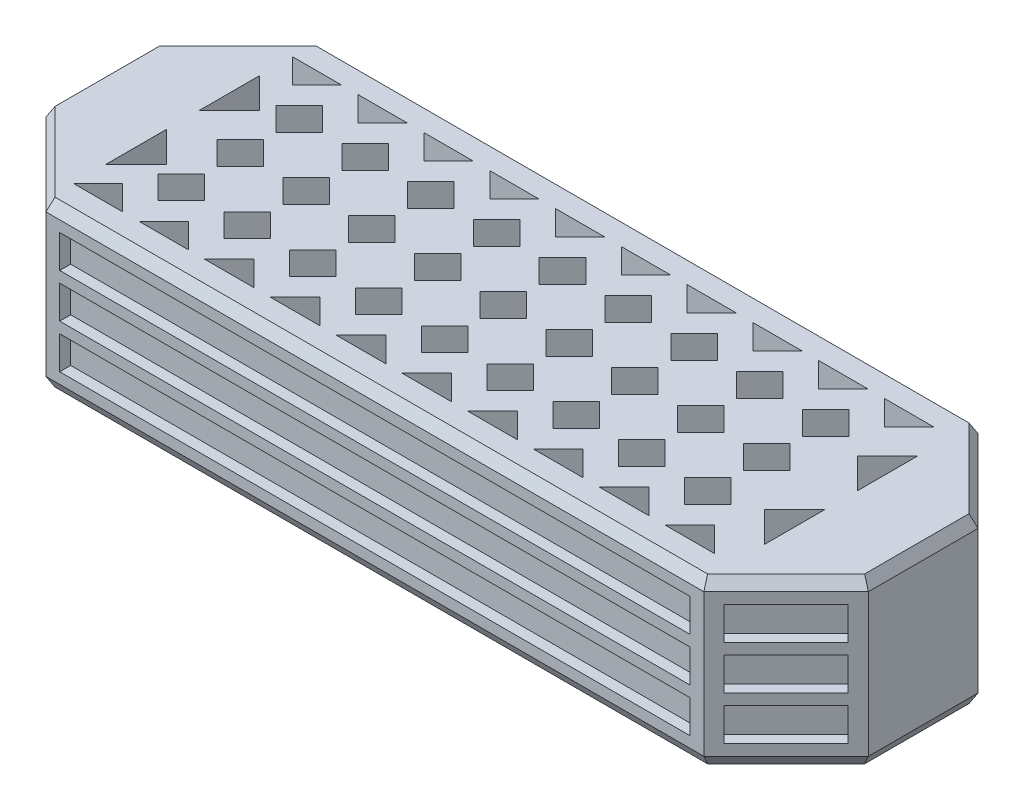
from build123d import *
from OCP.BRepFilletAPI import BRepFilletAPI_MakeChamfer

# Parameters (mm, degrees)
SKETCH2_W               = 150
SKETCH2_H               = 50
BOSS_EXTRUDE2_DEPTH     = 30
CHAMFER1_SIZE           = 15
SKETCH3_W               = 115
SKETCH3_H               = 6
CUT_EXTRUDE1_DEPTH      = 2
CUT_EXTRUDE3_DEPTH      = 30
SKETCH4_W               = 16
SKETCH4_H               = 6
CUT_EXTRUDE5_DEPTH      = 2
MIRROR5_COPY_1_SKETCH_W = 16
MIRROR5_COPY_1_SKETCH_H = 6
MIRROR5_COPY_1_DEPTH    = 2
CHAMFER2_SIZE           = 2
CHAMFER2_SIZE2          = 1.154700538


with BuildPart() as part:
    # Sketch2 → Boss-Extrude2 (new body)
    with BuildSketch(Plane(origin=(0, 0, 0), x_dir=(1, 0, 0), z_dir=(0, 1, 0))):
        Rectangle(SKETCH2_W, SKETCH2_H)
    extrude(amount=BOSS_EXTRUDE2_DEPTH)

    # Chamfer1
    chamfer1_edges = [part.edges().sort_by_distance(p)[0] for p in [
        (75, 15, 25),
        (-75, 15, 25),
        (-75, 15, -25),
        (75, 15, -25),
    ]]
    chamfer(chamfer1_edges, length=CHAMFER1_SIZE)

    # Sketch3 → Cut-Extrude1 (cut)
    with BuildSketch(Plane.XY.offset(25)):
        with Locations((0, 23)):
            Rectangle(SKETCH3_W, SKETCH3_H)
        with Locations((0, 15)):
            Rectangle(SKETCH3_W, SKETCH3_H)
        with Locations((0, 7)):
            Rectangle(SKETCH3_W, SKETCH3_H)
    cut_extrude1 = extrude(amount=-CUT_EXTRUDE1_DEPTH, mode=Mode.SUBTRACT)

    # Mirror1: Cut-Extrude1 across plane
    add(cut_extrude1.mirror(Plane.XY), mode=Mode.SUBTRACT)

    # Sketch5 → Cut-Extrude3 (cut)
    with BuildSketch(Plane(origin=(0, 30, 0), x_dir=(1, 0, 0), z_dir=(0, 1, 0))):
        Polygon((60.050252532, -14), (60.050252532, -3), (54.550252532, -8.5), align=None)
        Polygon((54.550252532, 8.5), (60.050252532, 14), (60.050252532, 3), align=None)
        Polygon((50.696370107, 10.757359313), (46.453729419, 15), (42.211088732, 10.757359313), (46.453729419, 6.514718626), align=None)
        Polygon((-54.550252532, -8.5), (-60.050252532, -14), (-60.050252532, -3), align=None)
        Polygon((-60.050252532, 3), (-54.550252532, 8.5), (-60.050252532, 14), align=None)
        Polygon((-55.535499317, 15.485246786), (-60.050252532, 20), (-51.020746103, 20), align=None)
        Polygon((-19.535499317, 15.485246786), (-24.050252532, 20), (-15.020746103, 20), align=None)
        Polygon((4.464500683, 15.485246786), (-0.050252532, 20), (8.979253897, 20), align=None)
        Polygon((16.464500683, 15.485246786), (11.949747468, 20), (20.979253897, 20), align=None)
        Polygon((28.464500683, 15.485246786), (23.949747468, 20), (32.979253897, 20), align=None)
        Polygon((40.464500683, 15.485246786), (35.949747468, 20), (44.979253897, 20), align=None)
        Polygon((38.696370107, 10.757359313), (34.453729419, 15), (30.211088732, 10.757359313), (34.453729419, 6.514718626), align=None)
        Polygon((26.696370107, 10.757359313), (22.453729419, 15), (18.211088732, 10.757359313), (22.453729419, 6.514718626), align=None)
        Polygon((14.696370107, 10.757359313), (10.453729419, 15), (6.211088732, 10.757359313), (10.453729419, 6.514718626), align=None)
        Polygon((2.696370107, 10.757359313), (-1.546270581, 15), (-5.788911268, 10.757359313), (-1.546270581, 6.514718626), align=None)
        Polygon((-9.303629893, 10.757359313), (-13.546270581, 15), (-17.788911268, 10.757359313), (-13.546270581, 6.514718626), align=None)
        Polygon((-21.303629893, 10.757359313), (-25.546270581, 15), (-29.788911268, 10.757359313), (-25.546270581, 6.514718626), align=None)
        Polygon((-33.303629893, 10.757359313), (-37.546270581, 15), (-41.788911268, 10.757359313), (-37.546270581, 6.514718626), align=None)
        Polygon((-45.303629893, 10.757359313), (-49.546270581, 15), (-53.788911268, 10.757359313), (-49.546270581, 6.514718626), align=None)
        Polygon((-45.325040554, 0), (-53.810321928, 0), (-49.567681241, -4.242640687), align=None)
        Polygon((-49.567681241, 4.242640687), (-53.810321928, 0), (-45.325040554, 0), align=None)
        Polygon((-45.303629893, -10.757359313), (-49.546270581, -15), (-53.788911268, -10.757359313), (-49.546270581, -6.514718626), align=None)
        Polygon((-51.020746103, -20), (-55.535499317, -15.485246786), (-60.050252532, -20), align=None)
        Polygon((-48.050252532, -20), (-39.020746103, -20), (-43.535499317, -15.485246786), align=None)
        Polygon((-37.546270581, -6.514718626), (-33.303629893, -10.757359313), (-37.546270581, -15), (-41.788911268, -10.757359313), align=None)
        Polygon((-36.050252532, -20), (-27.020746103, -20), (-31.535499317, -15.485246786), align=None)
        Polygon((-24.050252532, -20), (-15.020746103, -20), (-19.535499317, -15.485246786), align=None)
        Polygon((47.949747468, -20), (56.979253897, -20), (52.464500683, -15.485246786), align=None)
        Polygon((46.453729419, -6.514718626), (50.696370107, -10.757359313), (46.453729419, -15), (42.211088732, -10.757359313), align=None)
        Polygon((23.949747468, -20), (32.979253897, -20), (28.464500683, -15.485246786), align=None)
        Polygon((22.453729419, -6.514718626), (26.696370107, -10.757359313), (22.453729419, -15), (18.211088732, -10.757359313), align=None)
        Polygon((11.949747468, -20), (20.979253897, -20), (16.464500683, -15.485246786), align=None)
        Polygon((10.453729419, -6.514718626), (14.696370107, -10.757359313), (10.453729419, -15), (6.211088732, -10.757359313), align=None)
        Polygon((34.453729419, -6.514718626), (38.696370107, -10.757359313), (34.453729419, -15), (30.211088732, -10.757359313), align=None)
        Polygon((-13.546270581, -6.514718626), (-9.303629893, -10.757359313), (-13.546270581, -15), (-17.788911268, -10.757359313), align=None)
        Polygon((-25.546270581, -6.514718626), (-21.303629893, -10.757359313), (-25.546270581, -15), (-29.788911268, -10.757359313), align=None)
        Polygon((-12.050252532, -20), (-3.020746103, -20), (-7.535499317, -15.485246786), align=None)
        Polygon((-0.050252532, -20), (8.979253897, -20), (4.464500683, -15.485246786), align=None)
        Polygon((-1.546270581, -6.514718626), (2.696370107, -10.757359313), (-1.546270581, -15), (-5.788911268, -10.757359313), align=None)
        Polygon((-1.567681241, -4.242640687), (2.674959446, 0), (-5.810321928, 0), align=None)
        Polygon((-5.810321928, 0), (2.674959446, 0), (-1.567681241, 4.242640687), align=None)
        Polygon((46.432318759, -4.242640687), (50.674959446, 0), (42.189678072, 0), align=None)
        Polygon((42.189678072, 0), (50.674959446, 0), (46.432318759, 4.242640687), align=None)
        Polygon((30.189678072, 0), (38.674959446, 0), (34.432318759, 4.242640687), align=None)
        Polygon((34.432318759, -4.242640687), (38.674959446, 0), (30.189678072, 0), align=None)
        Polygon((18.189678072, 0), (26.674959446, 0), (22.432318759, 4.242640687), align=None)
        Polygon((22.432318759, -4.242640687), (26.674959446, 0), (18.189678072, 0), align=None)
        Polygon((-37.567681241, 4.242640687), (-41.810321928, 0), (-33.325040554, 0), align=None)
        Polygon((-33.325040554, 0), (-41.810321928, 0), (-37.567681241, -4.242640687), align=None)
        Polygon((-25.567681241, 4.242640687), (-29.810321928, 0), (-21.325040554, 0), align=None)
        Polygon((-21.325040554, 0), (-29.810321928, 0), (-25.567681241, -4.242640687), align=None)
        Polygon((-9.325040554, 0), (-17.810321928, 0), (-13.567681241, -4.242640687), align=None)
        Polygon((-13.567681241, 4.242640687), (-17.810321928, 0), (-9.325040554, 0), align=None)
        Polygon((6.189678072, 0), (14.674959446, 0), (10.432318759, 4.242640687), align=None)
        Polygon((10.432318759, -4.242640687), (14.674959446, 0), (6.189678072, 0), align=None)
        Polygon((-48.050252532, 20), (-39.020746103, 20), (-43.535499317, 15.485246786), align=None)
        Polygon((-36.050252532, 20), (-27.020746103, 20), (-31.535499317, 15.485246786), align=None)
        Polygon((-7.535499317, 15.485246786), (-12.050252532, 20), (-3.020746103, 20), align=None)
        Polygon((47.949747468, 20), (56.979253897, 20), (52.464500683, 15.485246786), align=None)
        Polygon((35.949747468, -20), (44.979253897, -20), (40.464500683, -15.485246786), align=None)
    extrude(amount=-CUT_EXTRUDE3_DEPTH, mode=Mode.SUBTRACT)

    # Sketch4 → Cut-Extrude5 (cut)
    with BuildSketch(Plane(origin=(-42.5, 0, 42.5), x_dir=(0.7071067811865464, 0, 0.7071067811865488), z_dir=(-0.7071067811865488, 0, 0.7071067811865464))):
        with Locations((-35.355339059, 7)):
            Rectangle(SKETCH4_W, SKETCH4_H)
        with Locations((-35.355339059, 15)):
            Rectangle(SKETCH4_W, SKETCH4_H)
        with Locations((-35.355339059, 23)):
            Rectangle(SKETCH4_W, SKETCH4_H)
    cut_extrude5 = extrude(amount=-CUT_EXTRUDE5_DEPTH, mode=Mode.SUBTRACT)

    # Mirror4: Cut-Extrude5 across plane
    add(cut_extrude5.mirror(Plane.XY), mode=Mode.SUBTRACT)

    # Mirror5: Cut-Extrude5 across plane
    add(cut_extrude5.mirror(Plane(origin=(0, 0, 0), x_dir=(0, 0, 1), z_dir=(1, 0, 0))), mode=Mode.SUBTRACT)

    # Mirror5 copy 1 sketch → Mirror5 copy 1 (cut)
    with BuildSketch(Plane(origin=(42.5, 0, -42.5), x_dir=(-0.7071067811865464, 0, -0.7071067811865488), z_dir=(0.7071067811865488, 0, -0.7071067811865464))):
        with Locations((-35.355339059, 7)):
            Rectangle(MIRROR5_COPY_1_SKETCH_W, MIRROR5_COPY_1_SKETCH_H)
        with Locations((-35.355339059, 15)):
            Rectangle(MIRROR5_COPY_1_SKETCH_W, MIRROR5_COPY_1_SKETCH_H)
        with Locations((-35.355339059, 23)):
            Rectangle(MIRROR5_COPY_1_SKETCH_W, MIRROR5_COPY_1_SKETCH_H)
    extrude(amount=-MIRROR5_COPY_1_DEPTH, mode=Mode.SUBTRACT)

    # Chamfer2: one chamfer whose edges measure the first distance from different faces: ONE call of the kernel's chamfer builder (chamfer() names one face for all edges)
    chamfer2_edges_1 = [part.edges().sort_by_distance(p)[0] for p in [
        (-75, 0, 0),
        (-75, 30, 0),
    ]]
    chamfer2_side_1 = [part.faces().sort_by_distance(p)[0] for p in [
        (-75, 15, 0),
    ]]
    chamfer2_edges_2 = [part.edges().sort_by_distance(p)[0] for p in [
        (75, 0, 0),
        (75, 30, 0),
    ]]
    chamfer2_side_2 = [part.faces().sort_by_distance(p)[0] for p in [
        (75, 15, 0),
    ]]
    chamfer2_edges_3 = [part.edges().sort_by_distance(p)[0] for p in [
        (0, 0, 25),
        (0, 30, 25),
    ]]
    chamfer2_side_3 = [part.faces().sort_by_distance(p)[0] for p in [
        (0, 1.236931688, 25),
    ]]
    chamfer2_edges_4 = [part.edges().sort_by_distance(p)[0] for p in [
        (0, 0, -25),
        (0, 30, -25),
    ]]
    chamfer2_side_4 = [part.faces().sort_by_distance(p)[0] for p in [
        (0, 1.236931688, -25),
    ]]
    chamfer2_edges_5 = [part.edges().sort_by_distance(p)[0] for p in [
        (-67.5, 0, 17.5),
        (-67.5, 30, 17.5),
    ]]
    chamfer2_side_5 = [part.faces().sort_by_distance(p)[0] for p in [
        (-67.5, 0.367423461, 17.5),
    ]]
    chamfer2_edges_6 = [part.edges().sort_by_distance(p)[0] for p in [
        (67.5, 0, 17.5),
        (67.5, 30, 17.5),
    ]]
    chamfer2_side_6 = [part.faces().sort_by_distance(p)[0] for p in [
        (67.5, 0.367423461, 17.5),
    ]]
    chamfer2_edges_7 = [part.edges().sort_by_distance(p)[0] for p in [
        (67.5, 0, -17.5),
        (67.5, 30, -17.5),
    ]]
    chamfer2_side_7 = [part.faces().sort_by_distance(p)[0] for p in [
        (67.5, 0.367423461, -17.5),
    ]]
    chamfer2_edges_8 = [part.edges().sort_by_distance(p)[0] for p in [
        (-67.5, 0, -17.5),
        (-67.5, 30, -17.5),
    ]]
    chamfer2_side_8 = [part.faces().sort_by_distance(p)[0] for p in [
        (-67.5, 0.367423461, -17.5),
    ]]
    chamfer2 = BRepFilletAPI_MakeChamfer(part.part.solid().wrapped)
    for e in chamfer2_edges_1:
        chamfer2.Add(CHAMFER2_SIZE, CHAMFER2_SIZE2, e.wrapped, chamfer2_side_1[0].wrapped)  # the first distance lies on this face
    for e in chamfer2_edges_2:
        chamfer2.Add(CHAMFER2_SIZE, CHAMFER2_SIZE2, e.wrapped, chamfer2_side_2[0].wrapped)  # the first distance lies on this face
    for e in chamfer2_edges_3:
        chamfer2.Add(CHAMFER2_SIZE, CHAMFER2_SIZE2, e.wrapped, chamfer2_side_3[0].wrapped)  # the first distance lies on this face
    for e in chamfer2_edges_4:
        chamfer2.Add(CHAMFER2_SIZE, CHAMFER2_SIZE2, e.wrapped, chamfer2_side_4[0].wrapped)  # the first distance lies on this face
    for e in chamfer2_edges_5:
        chamfer2.Add(CHAMFER2_SIZE, CHAMFER2_SIZE2, e.wrapped, chamfer2_side_5[0].wrapped)  # the first distance lies on this face
    for e in chamfer2_edges_6:
        chamfer2.Add(CHAMFER2_SIZE, CHAMFER2_SIZE2, e.wrapped, chamfer2_side_6[0].wrapped)  # the first distance lies on this face
    for e in chamfer2_edges_7:
        chamfer2.Add(CHAMFER2_SIZE, CHAMFER2_SIZE2, e.wrapped, chamfer2_side_7[0].wrapped)  # the first distance lies on this face
    for e in chamfer2_edges_8:
        chamfer2.Add(CHAMFER2_SIZE, CHAMFER2_SIZE2, e.wrapped, chamfer2_side_8[0].wrapped)  # the first distance lies on this face
    add(Compound.cast(chamfer2.Shape()), mode=Mode.REPLACE)


solid = part.part
